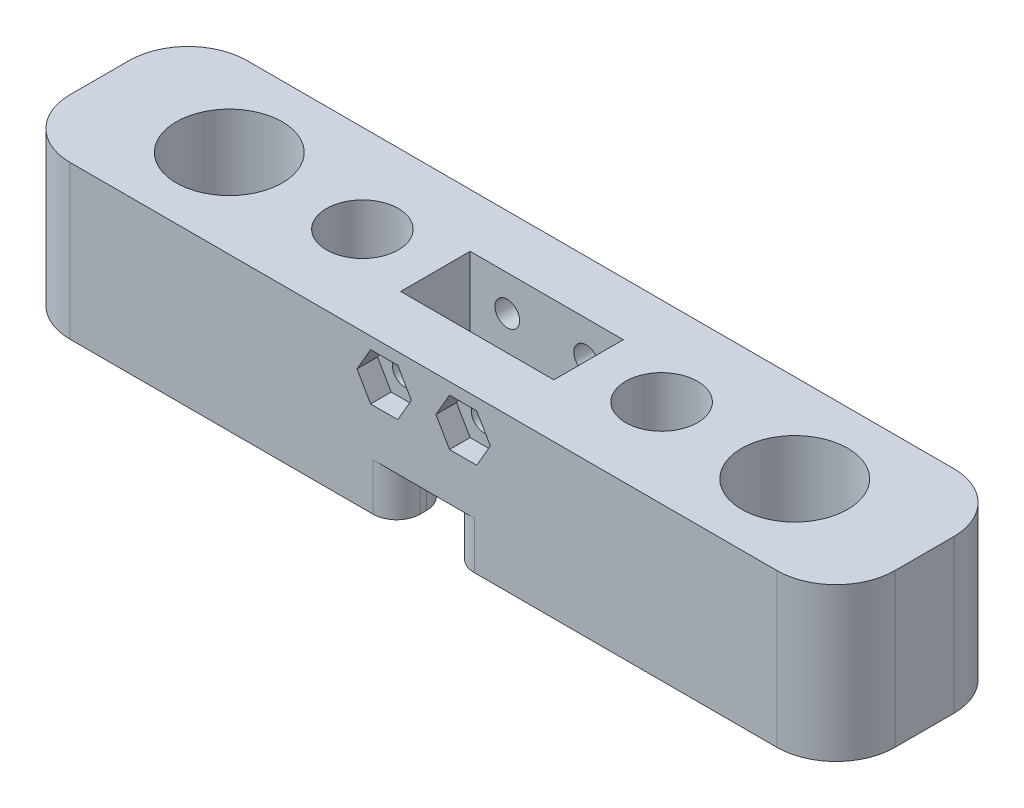
from build123d import *

# Parameters (mm, degrees)
SKETCH1_W                = 40
SKETCH1_H                = 13
SWITCHCASE_DEPTH         = 15
SKETCH2_W                = 13
SKETCH2_H                = 5.9
SWITCHCAVITY_DEPTH       = 45.654227124
SWITCHM2HOLES_DEPTH      = 44.338233697
SWITCHM2HOLES_DEPTH_BACK = 44.338233697
SKETCH3_R                = 1.05
SKETCH14_R               = 2
M2HEAD_DEPTH             = 1.5
M2NUTINSERTS_DEPTH       = 45.654227124
M2NUTINSERTS_DEPTH_BACK  = 1.75
SKETCH7_W                = 15
SKETCH7_H                = 13
WINGS_DEPTH              = 15
M5NUTS_DEPTH             = 4
SKETCH10_R               = 3.05
M6HOLE_DEPTH             = 59.472215624
WIRECHANNEL_DEPTH        = 58.473493891
WIRECHANNEL_DEPTH_BACK   = 58.473493891
SKETCH11_W               = 4.6
SKETCH11_H               = 4
CHANNELFILLET_R          = 2
M5HEAD_DEPTH             = 59.472215624
M5HEAD_DEPTH_BACK        = 8
SKETCH12_R               = 4.5
SKETCH13_R               = 2.75
M5THREAD_DEPTH           = 59.472215624
ENDFILLET_R              = 5


with BuildPart() as part:
    # Sketch1 → SwitchCase (new body)
    with BuildSketch(Plane.XY):
        with Locations((20, 6.5)):
            Rectangle(SKETCH1_W, SKETCH1_H)
    extrude(amount=SWITCHCASE_DEPTH)

    # Sketch2 → SwitchCavity (cut, through all)
    with BuildSketch(Plane(origin=(0, 13, 0), x_dir=(1, 0, 0), z_dir=(0, 1, 0))):
        with Locations((20, -7.5)):
            Rectangle(SKETCH2_W, SKETCH2_H)
    extrude(amount=-SWITCHCAVITY_DEPTH, mode=Mode.SUBTRACT)

    # Sketch3 → SwitchM2Holes (cut, two sides: drawn at the far end of the back side and taken through both)
    with BuildSketch(Plane.XY.offset(4.55).offset(-SWITCHM2HOLES_DEPTH_BACK)):
        with Locations((16.65, 10)):
            Circle(SKETCH3_R)
        with Locations((23.35, 10)):
            Circle(SKETCH3_R)
    extrude(amount=SWITCHM2HOLES_DEPTH + SWITCHM2HOLES_DEPTH_BACK, mode=Mode.SUBTRACT)

    # Sketch14 → M2Head (cut)
    with BuildSketch(Plane(origin=(0, 0, 0), x_dir=(-1, 0, 0), z_dir=(0, 0, -1))):
        with Locations((-23.35, 10)):
            Circle(SKETCH14_R)
        with Locations(Location((-16.65, 10, 0), (0, 0, 180))):
            Circle(SKETCH14_R)
    extrude(amount=-M2HEAD_DEPTH, mode=Mode.SUBTRACT)

    # Sketch5 → M2NutInserts (cut, two sides: drawn at the far end of the back side and taken through both)
    with BuildSketch(Plane.XY.offset(15).offset(-M2NUTINSERTS_DEPTH_BACK)):
        Polygon((18.959401077, 10), (17.804700538, 12), (15.495299462, 12), (14.340598923, 10), (15.495299462, 8), (17.804700538, 8), align=None)
        Polygon((25.659401077, 10), (24.504700538, 12), (22.195299462, 12), (21.040598923, 10), (22.195299462, 8), (24.504700538, 8), align=None)
    extrude(amount=M2NUTINSERTS_DEPTH + M2NUTINSERTS_DEPTH_BACK, mode=Mode.SUBTRACT)

    # Sketch7 → Wings (add)
    with BuildSketch(Plane.XY.offset(15)):
        with Locations((-7.5, 6.5)):
            Rectangle(SKETCH7_W, SKETCH7_H)
        with Locations((47.5, 6.5)):
            Rectangle(SKETCH7_W, SKETCH7_H)
    extrude(amount=-WINGS_DEPTH)

    # Sketch9 → M5Nuts (cut)
    with BuildSketch(Plane.XZ):
        Polygon((37.232199613, 7.5), (34.966099807, 11.425), (30.433900193, 11.425), (28.167800387, 7.5), (30.433900193, 3.575), (34.966099807, 3.575), align=None)
        Polygon((5.033900193, 3.575), (2.767800387, 7.5), (5.033900193, 11.425), (9.566099807, 11.425), (11.832199613, 7.5), (9.566099807, 3.575), align=None)
    extrude(amount=-M5NUTS_DEPTH, mode=Mode.SUBTRACT)

    # Sketch10 → M6Hole (cut, through all)
    with BuildSketch(Plane.XZ):
        with Locations(Location((7.3, 7.5, 0), (0, 0, 270))):
            Circle(SKETCH10_R)
        with Locations(Location((32.7, 7.5, 0), (0, 0, 270))):
            Circle(SKETCH10_R)
    extrude(amount=-M6HOLE_DEPTH, mode=Mode.SUBTRACT)

    # Sketch11 → WireChannel (cut, two sides: drawn at the far end of the back side and taken through both)
    with BuildSketch(Plane.XY.offset(4.55).offset(-WIRECHANNEL_DEPTH_BACK)):
        with Locations((20, 2)):
            Rectangle(SKETCH11_W, SKETCH11_H)
    extrude(amount=WIRECHANNEL_DEPTH + WIRECHANNEL_DEPTH_BACK, mode=Mode.SUBTRACT)

    # ChannelFillet
    channelfillet_edges = [part.edges().sort_by_distance(p)[0] for p in [
        (20, 4, 10.45),
        (17.7, 2, 10.45),
        (22.3, 2, 10.45),
        (22.3, 2, 4.55),
        (22.3, 2, 0),
        (17.7, 2, 4.55),
        (17.7, 2, 0),
        (20, 4, 4.55),
        (22.3, 2, 15),
        (17.7, 2, 15),
    ]]
    fillet(channelfillet_edges, radius=CHANNELFILLET_R)

    # Sketch12 → M5Head (cut, two sides: drawn at the far end of the back side and taken through both)
    with BuildSketch(Plane(origin=(0, 13, 0), x_dir=(1, 0, 0), z_dir=(0, 1, 0)).offset(-M5HEAD_DEPTH_BACK)):
        with Locations(Location((44, -7.5, 0), (0, 0, 90))):
            Circle(SKETCH12_R)
        with Locations(Location((-4, -7.5, 0), (0, 0, 90))):
            Circle(SKETCH12_R)
    extrude(amount=M5HEAD_DEPTH + M5HEAD_DEPTH_BACK, mode=Mode.SUBTRACT)

    # Sketch13 → M5Thread (cut, through all)
    with BuildSketch(Plane(origin=(0, 13, 0), x_dir=(1, 0, 0), z_dir=(0, 1, 0))):
        with Locations(Location((44, -7.5, 0), (0, 0, 270))):
            Circle(SKETCH13_R)
        with Locations(Location((-4, -7.5, 0), (0, 0, 90))):
            Circle(SKETCH13_R)
    extrude(amount=-M5THREAD_DEPTH, mode=Mode.SUBTRACT)

    # EndFillet
    endfillet_edges = [part.edges().sort_by_distance(p)[0] for p in [
        (-15, 6.5, 15),
        (-15, 6.5, 0),
        (55, 6.5, 15),
        (55, 6.5, 0),
    ]]
    fillet(endfillet_edges, radius=ENDFILLET_R)


solid = part.part
